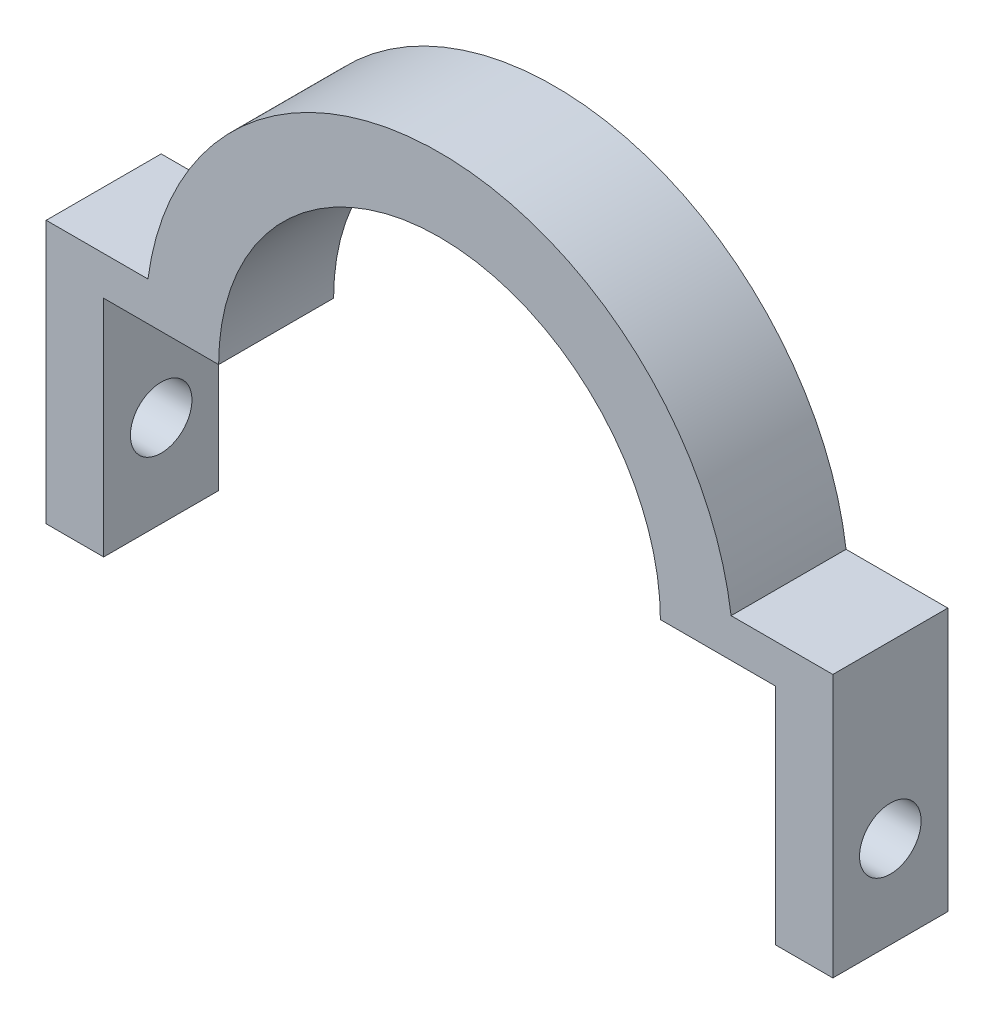
from build123d import *

# Parameters (mm, degrees)
BOSS_EXTRUDE1_DEPTH     = 6.35
CUT_EXTRUDE1_DEPTH      = 53.418642591
CUT_EXTRUDE1_DEPTH_BACK = 53.418642591
SKETCH2_R               = 1.7


with BuildPart() as part:
    # Sketch1 → Boss-Extrude1 (new body)
    with BuildSketch(Plane.XY):
        with BuildLine():
            Line((39.411995156, 14.521042354), (45.031969649, 14.521042354))
            Line((45.031969649, 14.521042354), (45.031969649, 0))
            Line((45.031969649, 0), (41.856969649, 0))
            Line((41.856969649, 0), (41.856969649, 12.38))
            Line((41.856969649, 12.38), (35.506969649, 12.38))
            ThreePointArc((35.506969649, 12.38), (23.306969665, 24.579999984), (11.106969681, 12.38))
            Line((11.106969681, 12.38), (4.756969681, 12.38))
            Line((4.756969681, 12.38), (4.756969681, 0))
            Line((4.756969681, 0), (1.581969681, 0))
            Line((1.581969681, 0), (1.581969681, 14.521042354))
            Line((1.581969681, 14.521042354), (7.201944173, 14.521042354))
            ThreePointArc((7.201944173, 14.521042354), (23.306969665, 28.626719929), (39.411995156, 14.521042354))
        make_face()
    extrude(amount=BOSS_EXTRUDE1_DEPTH)

    # Sketch2 → Cut-Extrude1 (cut, two sides: drawn at the far end of the back side and taken through both)
    with BuildSketch(Plane(origin=(45.031969649, 0, 0), x_dir=(0, 0, -1), z_dir=(1, 0, 0)).offset(-CUT_EXTRUDE1_DEPTH_BACK)):
        with Locations((-3.175, 5.08)):
            Circle(SKETCH2_R)
    extrude(amount=CUT_EXTRUDE1_DEPTH + CUT_EXTRUDE1_DEPTH_BACK, mode=Mode.SUBTRACT)


solid = part.part
